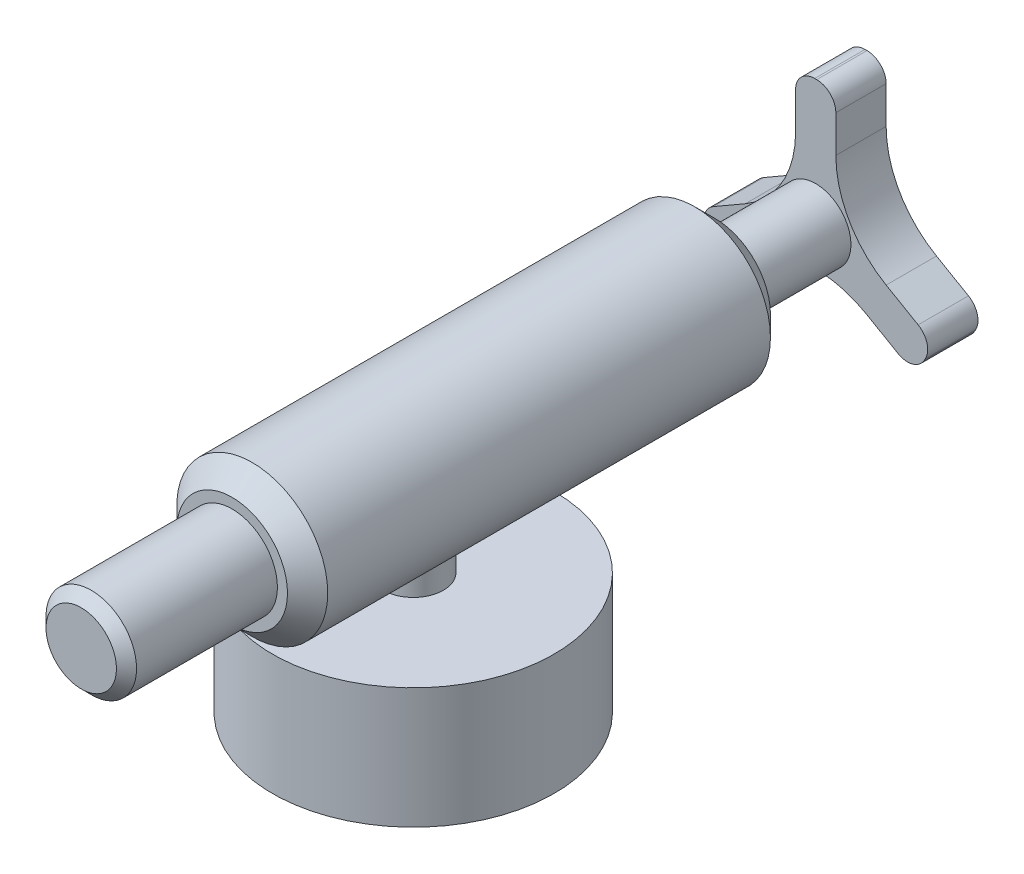
from build123d import *

# Parameters (mm, degrees)
BOSS_EXTRU_1_DEPTH      = 18
BOSS_EXTRU_1_DEPTH_BACK = 30
ESQUISSE2_R             = 7.5
CHANFREIN1_SIZE         = 2
ESQUISSE3_R             = 4.5
BOSS_EXTRU_2_DEPTH      = 15
CHANFREIN2_SIZE         = 1
ESQUISSE4_R             = 3.5
BOSS_EXTRU_3_DEPTH      = 10
BOSS_EXTRU_4_DEPTH      = 5


with BuildPart() as part:
    # Esquisse1 → Révolution1 (revolve)
    with BuildSketch(Plane.XY, mode=Mode.PRIVATE) as r_volution1_sk:
        Polygon((-12, 0), (-14, 0), (-14, 12), (-3, 12), (-3, 18), (0, 18), (0, 0), (-10, 0), (-10, 10), (-12, 10), align=None)
    revolve(r_volution1_sk.sketch.rotate(Axis((0, 0, 0), (0, 1, 0)), 270), axis=Axis((0, 0, 0), (0, 1, 0)))

    # Esquisse2 → Boss.-Extru.1 (add, two sides: drawn at the far end of the back side and taken through both)
    with BuildSketch(Plane.XY.offset(-BOSS_EXTRU_1_DEPTH_BACK)):
        with Locations((0, 22)):
            Circle(ESQUISSE2_R)
    extrude(amount=BOSS_EXTRU_1_DEPTH + BOSS_EXTRU_1_DEPTH_BACK)

    # Chanfrein1
    chanfrein1_edges = [part.edges().sort_by_distance(p)[0] for p in [
        (-7.5, 22, -30),
        (-7.5, 22, 18),
    ]]
    chamfer(chanfrein1_edges, length=CHANFREIN1_SIZE)

    # Esquisse3 → Boss.-Extru.2 (add)
    with BuildSketch(Plane.XY.offset(18)):
        with Locations((0, 22)):
            Circle(ESQUISSE3_R)
    extrude(amount=BOSS_EXTRU_2_DEPTH)

    # Chanfrein2
    chanfrein2_edges = [part.edges().sort_by_distance(p)[0] for p in [
        (-4.5, 22, 33),
    ]]
    chamfer(chanfrein2_edges, length=CHANFREIN2_SIZE)

    # Esquisse4 → Boss.-Extru.3 (add)
    with BuildSketch(Plane(origin=(0, 0, -30), x_dir=(-1, 0, 0), z_dir=(0, 0, -1))):
        with Locations((0, 22)):
            Circle(ESQUISSE4_R)
    extrude(amount=BOSS_EXTRU_3_DEPTH)

    # Esquisse5 → Boss.-Extru.4 (add)
    with BuildSketch(Plane(origin=(0, 0, -40), x_dir=(-1, 0, 0), z_dir=(0, 0, -1))):
        with BuildLine():
            Line((-2, 28.92820323), (-2, 32.6))
            ThreePointArc((-2, 32.6), (-1.443502884, 33.943502884), (-0.1, 34.5))
            Line((-0.1, 34.5), (0.1, 34.5))
            ThreePointArc((0.1, 34.5), (1.443502884, 33.943502884), (2, 32.6))
            Line((2, 32.6), (2, 28.92820323))
            ThreePointArc((2, 28.92820323), (3.339745962, 23.92820323), (7, 20.267949192))
            Line((7, 20.267949192), (10.17986928, 18.432050808))
            ThreePointArc((10.17986928, 18.432050808), (11.06512835, 17.278358726), (10.875317547, 15.83660254))
            Line((10.875317547, 15.83660254), (10.775317547, 15.66339746))
            ThreePointArc((10.775317547, 15.66339746), (9.621625466, 14.77813839), (8.17986928, 14.967949192))
            Line((8.17986928, 14.967949192), (5, 16.803847577))
            ThreePointArc((5, 16.803847577), (0, 18.143593539), (-5, 16.803847577))
            Line((-5, 16.803847577), (-8.17986928, 14.967949192))
            ThreePointArc((-8.17986928, 14.967949192), (-9.621625466, 14.77813839), (-10.775317547, 15.66339746))
            Line((-10.775317547, 15.66339746), (-10.875317547, 15.83660254))
            ThreePointArc((-10.875317547, 15.83660254), (-11.06512835, 17.278358726), (-10.17986928, 18.432050808))
            Line((-10.17986928, 18.432050808), (-7, 20.267949192))
            ThreePointArc((-7, 20.267949192), (-3.339745962, 23.92820323), (-2, 28.92820323))
        make_face()
    extrude(amount=BOSS_EXTRU_4_DEPTH)


solid = part.part
